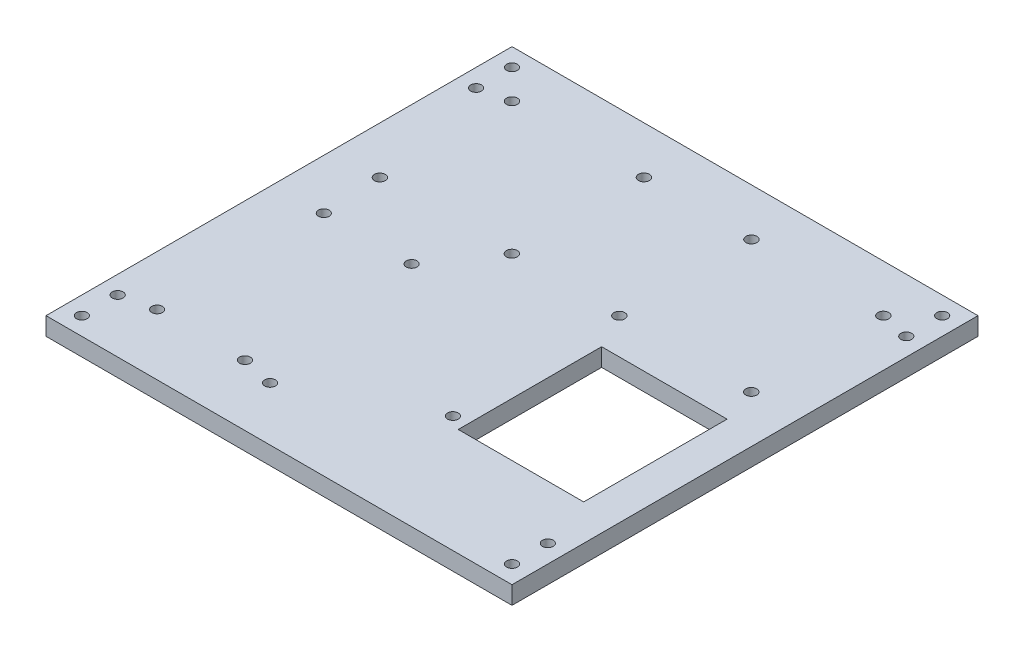
from build123d import *

# Parameters (mm, degrees)
SKETCH1_W           = 130
SKETCH1_H           = 130
BOSS_EXTRUDE1_DEPTH = 5
SKETCH4_R           = 1.5
CUT_EXTRUDE1_DEPTH  = 5
SKETCH8_R           = 1.5
CUT_EXTRUDE4_DEPTH  = 5
SKETCH9_W           = 35
SKETCH9_H           = 40
CUT_EXTRUDE5_DEPTH  = 5
SKETCH10_R          = 1.5
CUT_EXTRUDE6_DEPTH  = 5
SKETCH11_R          = 1.525
SKETCH11_R_2        = 1.5
CUT_EXTRUDE7_DEPTH  = 5
SKETCH12_R          = 1.5
CUT_EXTRUDE8_DEPTH  = 5


with BuildPart() as part:
    # Sketch1 → Boss-Extrude1 (new body)
    with BuildSketch(Plane(origin=(0, 0, 0), x_dir=(1, 0, 0), z_dir=(0, 1, 0))):
        Rectangle(SKETCH1_W, SKETCH1_H)
    extrude(amount=BOSS_EXTRUDE1_DEPTH)

    # Sketch4 → Cut-Extrude1 (cut)
    with BuildSketch(Plane(origin=(0, 5, 0), x_dir=(1, 0, 0), z_dir=(0, 1, 0))):
        with Locations(Location((60, 60, 0), (0, 0, 270))):
            Circle(SKETCH4_R)
        with Locations(Location((60, -60, 0), (0, 0, 270))):
            Circle(SKETCH4_R)
        with Locations(Location((-60, -60, 0), (0, 0, 270))):
            Circle(SKETCH4_R)
        with Locations(Location((-60, 60, 0), (0, 0, 270))):
            Circle(SKETCH4_R)
    extrude(amount=-CUT_EXTRUDE1_DEPTH, mode=Mode.SUBTRACT)

    # Sketch8 → Cut-Extrude4 (cut)
    with BuildSketch(Plane(origin=(0, 5, 0), x_dir=(1, 0, 0), z_dir=(0, 1, 0))):
        with Locations(Location((-60, 50, 0), (0, 0, 270))):
            Circle(SKETCH8_R)
        with Locations(Location((60, 50, 0), (0, 0, 270))):
            Circle(SKETCH8_R)
        with Locations(Location((60, -50, 0), (0, 0, 270))):
            Circle(SKETCH8_R)
        with Locations(Location((-60, -50, 0), (0, 0, 270))):
            Circle(SKETCH8_R)
    extrude(amount=-CUT_EXTRUDE4_DEPTH, mode=Mode.SUBTRACT)

    # Sketch9 → Cut-Extrude5 (cut)
    with BuildSketch(Plane(origin=(0, 5, 0), x_dir=(1, 0, 0), z_dir=(0, 1, 0))):
        with Locations((37.5, -15)):
            Rectangle(SKETCH9_W, SKETCH9_H)
    extrude(amount=-CUT_EXTRUDE5_DEPTH, mode=Mode.SUBTRACT)

    # Sketch10 → Cut-Extrude6 (cut)
    with BuildSketch(Plane(origin=(0, 5, 0), x_dir=(1, 0, 0), z_dir=(0, 1, 0))):
        with Locations(Location((-17.5, -50, 0), (0, 0, 270))):
            Circle(SKETCH10_R)
    extrude(amount=-CUT_EXTRUDE6_DEPTH, mode=Mode.SUBTRACT)

    # Sketch11 → Cut-Extrude7 (cut)
    with BuildSketch(Plane(origin=(0, 5, 0), x_dir=(1, 0, 0), z_dir=(0, 1, 0))):
        with Locations(Location((-51.803699422, 51.8, 0), (0, 0, 270))):
            Circle(SKETCH11_R)
        with Locations(Location((-14.996300578, 51.8, 0), (0, 0, 270))):
            Circle(SKETCH11_R)
        with Locations(Location((14.996300578, 51.8, 0), (0, 0, 270))):
            Circle(SKETCH11_R)
        with Locations(Location((51.803699422, 51.8, 0), (0, 0, 270))):
            Circle(SKETCH11_R)
        with Locations(Location((51.803699422, 14.95, 0), (0, 0, 270))):
            Circle(SKETCH11_R)
        with Locations(Location((14.996300578, 14.95, 0), (0, 0, 270))):
            Circle(SKETCH11_R)
        with Locations(Location((-14.996300578, 14.95, 0), (0, 0, 270))):
            Circle(SKETCH11_R)
        with Locations(Location((-51.803699422, 14.95, 0), (0, 0, 270))):
            Circle(SKETCH11_R)
        with Locations(Location((-51, -1.5, 0), (0, 0, 270))):
            Circle(SKETCH11_R_2)
        with Locations(Location((-26.5, -1.5, 0), (0, 0, 270))):
            Circle(SKETCH11_R_2)
        with Locations(Location((-26.5, -48, 0), (0, 0, 270))):
            Circle(SKETCH11_R_2)
        with Locations(Location((-51, -48, 0), (0, 0, 270))):
            Circle(SKETCH11_R_2)
    extrude(amount=-CUT_EXTRUDE7_DEPTH, mode=Mode.SUBTRACT)

    # Sketch12 → Cut-Extrude8 (cut)
    with BuildSketch(Plane(origin=(0, 5, 0), x_dir=(1, 0, 0), z_dir=(0, 1, 0))):
        with Locations(Location((16, -32.5, 0), (0, 0, 270))):
            Circle(SKETCH12_R)
    extrude(amount=-CUT_EXTRUDE8_DEPTH, mode=Mode.SUBTRACT)


solid = part.part
